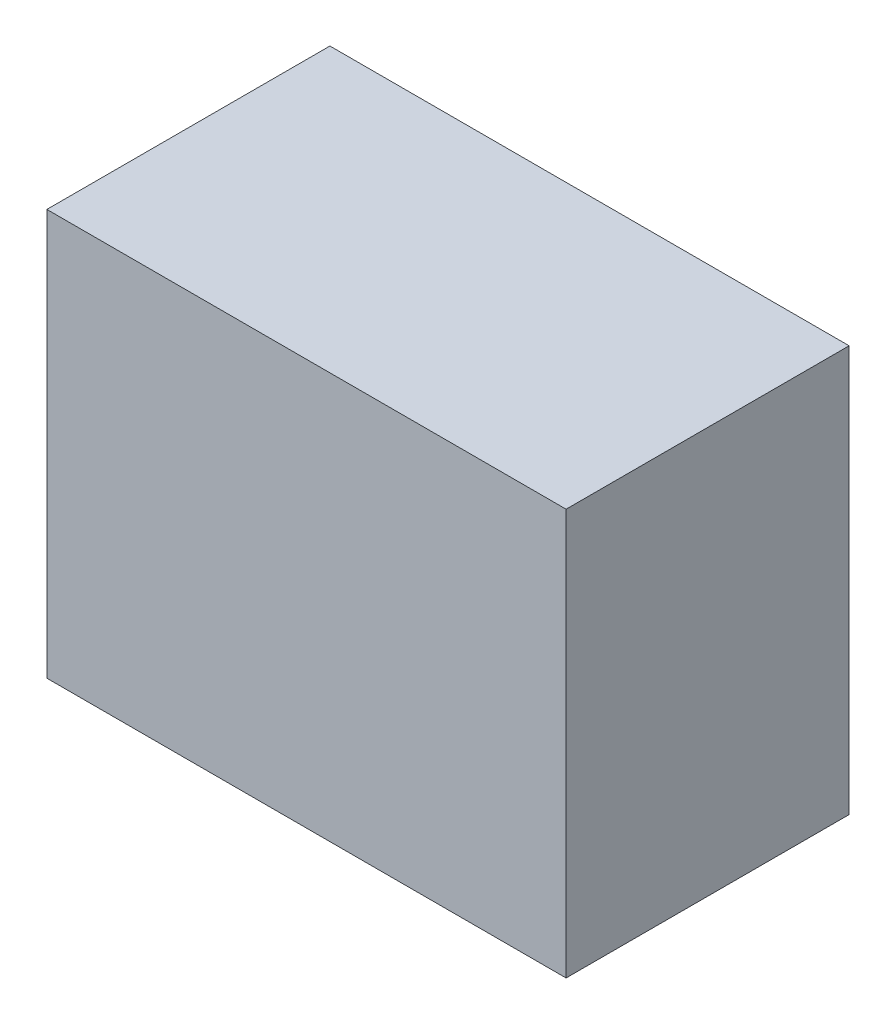
from build123d import *

# Parameters (mm, degrees)
SKETCH1_W           = 26.6
SKETCH1_H           = 20.8
BOSS_EXTRUDE1_DEPTH = 14.5


with BuildPart() as part:
    # Sketch1 → Boss-Extrude1 (new body)
    with BuildSketch(Plane.XY):
        with Locations((13.3, 10.4)):
            Rectangle(SKETCH1_W, SKETCH1_H)
    extrude(amount=BOSS_EXTRUDE1_DEPTH)


solid = part.part
